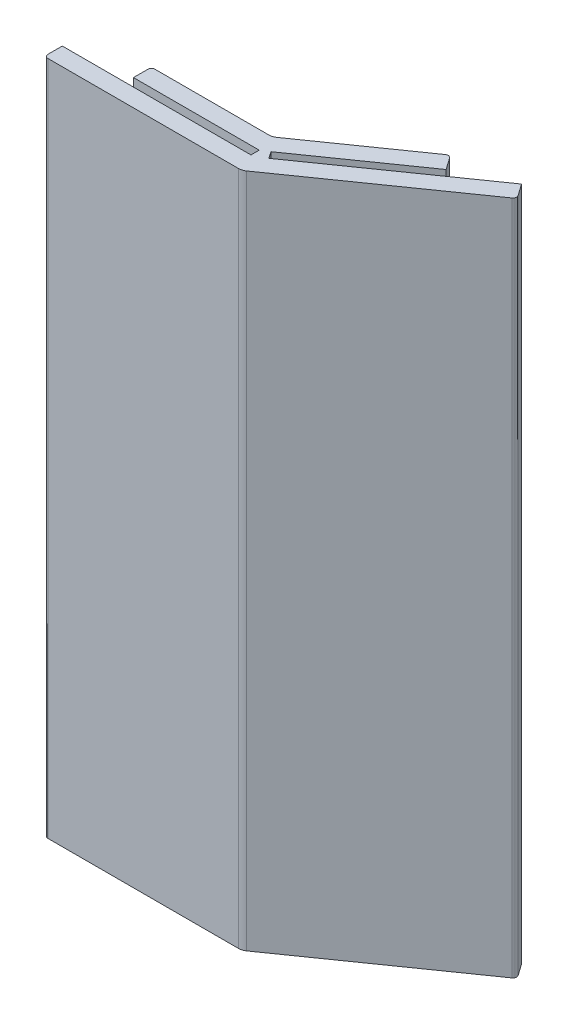
from build123d import *

# Parameters (mm, degrees)
BOSS_EXTRUDE1_DEPTH = 188


with BuildPart() as part:
    # Sketch2 → Boss-Extrude1 (new body)
    with BuildSketch(Plane(origin=(0, 0, 0), x_dir=(1, 0, 0), z_dir=(0, 1, 0))):
        with BuildLine():
            Line((-0.945896367, 0), (-54, 0))
            ThreePointArc((-54, 0), (-54.707106781, 0.292893219), (-55, 1))
            Line((-55, 1), (-55, 5))
            Line((-55, 5), (-2.487604379, 5))
            Line((-2.487604379, 5), (-2.487604379, 7.3))
            Line((-2.487604379, 7.3), (-37.487604379, 7.3))
            Line((-37.487604379, 7.3), (-37.487604379, 11.3))
            ThreePointArc((-37.487604379, 11.3), (-37.19471116, 12.007106781), (-36.487604379, 12.3))
            Line((-36.487604379, 12.3), (-4.82407147, 12.3))
            ThreePointArc((-4.82407147, 12.3), (-3.921954071, 12.438849148), (-3.103342161, 12.842543867))
            Line((-3.103342161, 12.842543867), (24.489595683, 32.163326947))
            ThreePointArc((24.489595683, 32.163326947), (25.236820297, 32.328982656), (25.882324164, 31.917751339))
            Line((25.882324164, 31.917751339), (28.176629909, 28.641143162))
            Line((28.176629909, 28.641143162), (-0.493691641, 8.56596789))
            Line((-0.493691641, 8.56596789), (0.825534163, 6.681918188))
            Line((0.825534163, 6.681918188), (42.185480254, 35.642464221))
            Line((42.185480254, 35.642464221), (44.479786, 32.365856044))
            ThreePointArc((44.479786, 32.365856044), (44.645441708, 31.61863143), (44.234210392, 30.973127563))
            Line((44.234210392, 30.973127563), (0.774832942, 0.542543867))
            ThreePointArc((0.774832942, 0.542543867), (-0.043778968, 0.138849148), (-0.945896367, 0))
        make_face()
    extrude(amount=BOSS_EXTRUDE1_DEPTH)


solid = part.part
